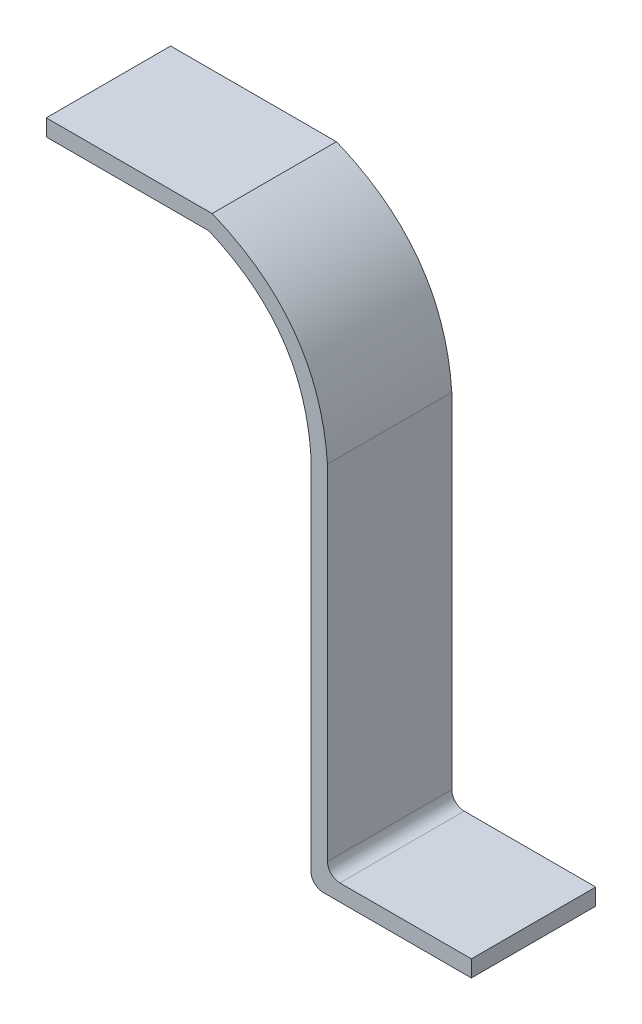
from build123d import *

# Parameters (mm, degrees)
BOSS_EXTRUDE1_DEPTH = 30


with BuildPart() as part:
    # Sketch1 → Boss-Extrude1 (new body)
    with BuildSketch(Plane.XY):
        with BuildLine():
            Line((-40, 38.556946986), (0, 38.556946986))
            add(Edge.make_bspline(
                [(0, 38.556946986), (25.885340012, 28.023752492), (27.824600918, 0.131180898)],
                knots=[0, 0, 0, 1, 1, 1], degree=2))
            Line((27.824600918, 0.131180898), (27.824600918, -82.868819102))
            ThreePointArc((27.824600918, -82.868819102), (28.703280574, -84.990139445), (30.824600918, -85.868819102))
            Line((30.824600918, -85.868819102), (62.541306618, -85.868819102))
            Line((62.541306618, -85.868819102), (62.541306618, -89.868819102))
            Line((62.541306618, -89.868819102), (27.824600918, -89.868819102))
            Line((27.824600918, -89.868819102), (26.824600918, -89.868819102))
            ThreePointArc((26.824600918, -89.868819102), (24.703280574, -88.990139445), (23.824600918, -86.868819102))
            Line((23.824600918, -86.868819102), (23.824600918, -0.01001344))
            add(Edge.make_bspline(
                [(-0.796307781, 34.556946986), (-0.313071462, 34.352718519), (0.65471267, 33.927572325), (2.509371581, 33.047404589), (4.716407797, 31.874992229), (7.176880305, 30.35963937), (10.215802607, 28.194209311), (13.569039872, 25.21811291), (16.917231379, 21.206114841), (19.621581596, 16.724458997), (21.351620726, 12.565197335), (22.419479521, 8.964412879), (23.060246931, 6.124694742), (23.459149076, 3.637055451), (23.695469018, 1.580241662), (23.786657543, 0.517816431), (23.824600918, -0.01001344)],
                knots=[0.014797718, 0.014797718, 0.014797718, 0.014797718, 0.045503656, 0.076209593, 0.137621468, 0.199033343, 0.260445218, 0.383268968, 0.506092718, 0.628916468, 0.751740218, 0.813152093, 0.874563968, 0.935975843, 0.966681781, 0.997387718, 0.997387718, 0.997387718, 0.997387718], degree=3))
            Line((-0.796307781, 34.556946986), (-40, 34.556946986))
            Line((-40, 34.556946986), (-40, 38.556946986))
        make_face()
    extrude(amount=BOSS_EXTRUDE1_DEPTH)


solid = part.part
